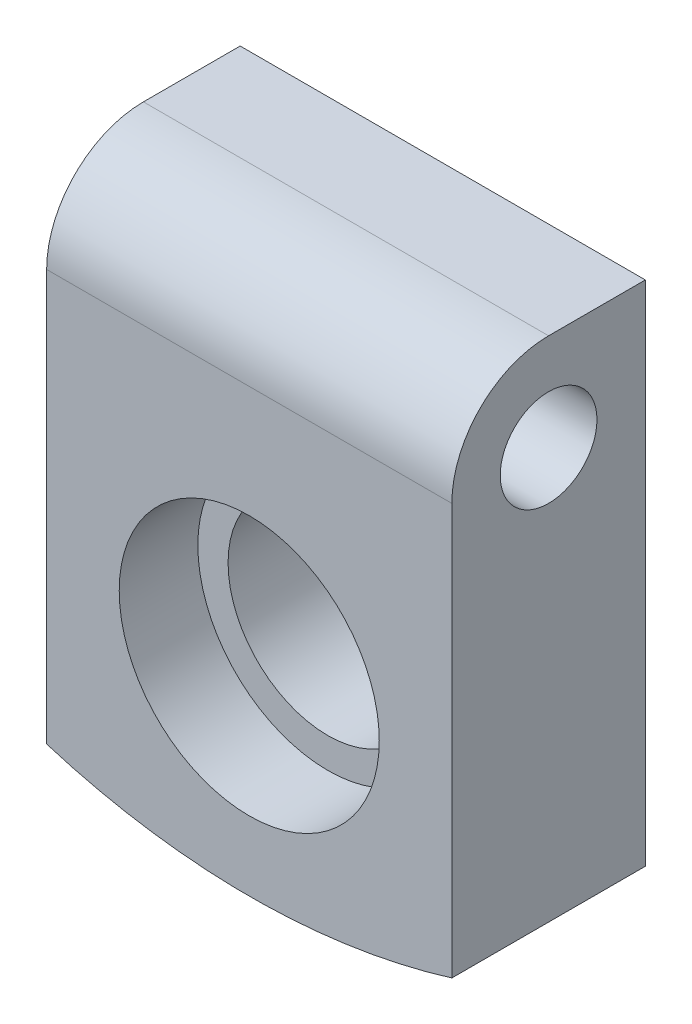
from build123d import *

# Parameters (mm, degrees)
Y_KSEKLIK_EKSTR_ZYON1_DEPTH = 16
KES_EKSTR_ZYON1_DEPTH       = 97.432618963
KES_EKSTR_ZYON1_DEPTH_BACK  = 97.432618963
KES_EKSTR_ZYON2_DEPTH       = 97.432618963
KES_EKSTR_ZYON2_DEPTH_BACK  = 97.432618963
IZIM3_R                     = 8


with BuildPart() as part:
    # Çizim1 → Yükseklik-Ekstrüzyon1 (new, symmetric)
    with BuildSketch(Plane.XY):
        with BuildLine():
            Line((-33.5, 0), (33.5, 0))
            Line((33.5, 0), (33.5, -83.966738044))
            ThreePointArc((33.5, -83.966738044), (0, -89), (-33.5, -83.966738044))
            Line((-33.5, -83.966738044), (-33.5, 0))
        make_face()
    extrude(amount=Y_KSEKLIK_EKSTR_ZYON1_DEPTH, both=True)

    # Çizim2 → Kes-Ekstrüzyon1 (cut, two sides: drawn at the far end of the back side and taken through both)
    with BuildSketch(Plane(origin=(0, 0, 0), x_dir=(0, 0, -1), z_dir=(1, 0, 0)).offset(-KES_EKSTR_ZYON1_DEPTH_BACK)):
        with BuildLine():
            Line((-16, -16), (-16, 0))
            Line((-16, 0), (0, 0))
            ThreePointArc((0, 0), (-11.313708499, -4.686291501), (-16, -16))
        make_face()
    extrude(amount=KES_EKSTR_ZYON1_DEPTH + KES_EKSTR_ZYON1_DEPTH_BACK, mode=Mode.SUBTRACT)

    # Çizim3 → Kes-Ekstrüzyon2 (cut, two sides: drawn at the far end of the back side and taken through both)
    with BuildSketch(Plane(origin=(0, 0, 0), x_dir=(0, 0, -1), z_dir=(1, 0, 0)).offset(-KES_EKSTR_ZYON2_DEPTH_BACK)):
        with Locations((0, -16)):
            Circle(IZIM3_R)
    extrude(amount=KES_EKSTR_ZYON2_DEPTH + KES_EKSTR_ZYON2_DEPTH_BACK, mode=Mode.SUBTRACT)

    # Çizim4 → Kes-Döndür1 (revolve, cut)
    with BuildSketch(Plane(origin=(0, 0, 0), x_dir=(0, 0, -1), z_dir=(1, 0, 0)), mode=Mode.PRIVATE) as kes_d_nd_r1_sk:
        Polygon((-16, -34.5), (-3, -34.5), (-3, -39.5), (16, -39.5), (16, -56), (-16, -56), align=None)
    revolve(kes_d_nd_r1_sk.sketch.rotate(Axis((0, -56, 16), (0, 0, -1)), 90), axis=Axis((0, -56, 16), (0, 0, -1)), mode=Mode.SUBTRACT)


solid = part.part
